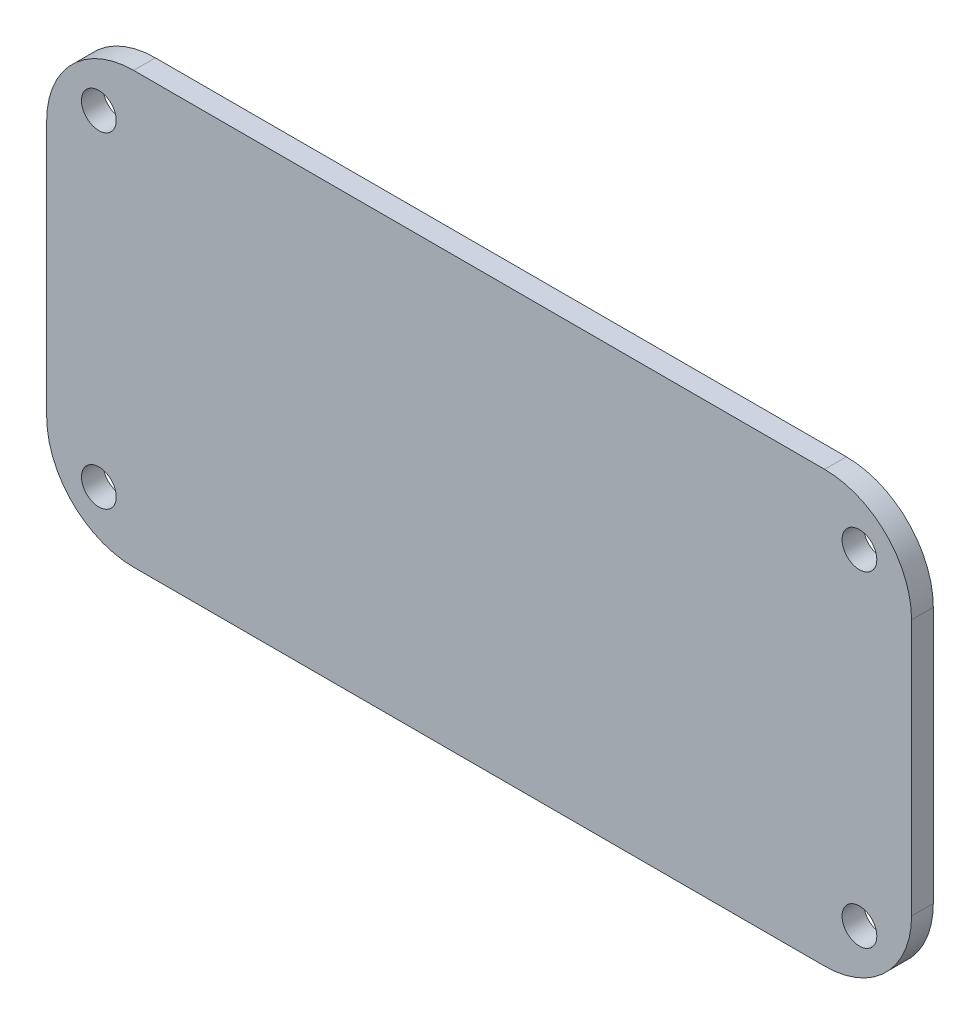
from build123d import *

# Parameters (mm, degrees)
SKETCH1_R           = 1.6
BOSS_EXTRUDE1_DEPTH = 2


with BuildPart() as part:
    # Sketch1 → Boss-Extrude1 (new body)
    with BuildSketch(Plane.XY):
        with BuildLine():
            Line((39.8, -11.8), (39.8, 11.8))
            ThreePointArc((39.8, 11.8), (37.456854249, 17.456854249), (31.8, 19.8))
            Line((31.8, 19.8), (-31.8, 19.8))
            ThreePointArc((-31.8, 19.8), (-37.456854249, 17.456854249), (-39.8, 11.8))
            Line((-39.8, 11.8), (-39.8, -11.8))
            ThreePointArc((-39.8, -11.8), (-37.456854249, -17.456854249), (-31.8, -19.8))
            Line((-31.8, -19.8), (31.8, -19.8))
            ThreePointArc((31.8, -19.8), (37.456854249, -17.456854249), (39.8, -11.8))
        make_face()
        with Locations((-35, 15)):
            Circle(SKETCH1_R, mode=Mode.SUBTRACT)
        with Locations((35, 15)):
            Circle(SKETCH1_R, mode=Mode.SUBTRACT)
        with Locations((35, -15)):
            Circle(SKETCH1_R, mode=Mode.SUBTRACT)
        with Locations((-35, -15)):
            Circle(SKETCH1_R, mode=Mode.SUBTRACT)
    extrude(amount=BOSS_EXTRUDE1_DEPTH)


solid = part.part
